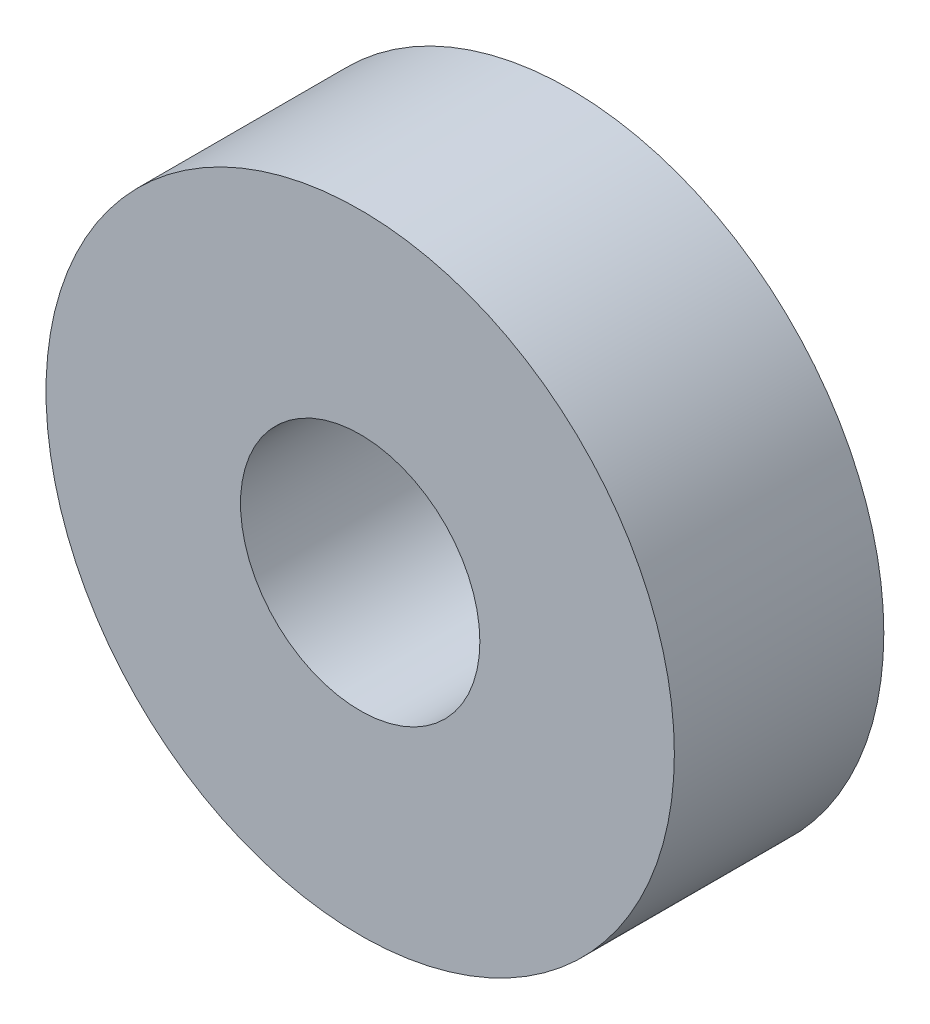
from build123d import *

# Parameters (mm, degrees)
ESQUISSE1_R        = 10.5
ESQUISSE1_R_2      = 4
BOSS_EXTRU_1_DEPTH = 7


with BuildPart() as part:
    # Esquisse1 → Boss.-Extru.1 (new body)
    with BuildSketch(Plane.XY):
        Circle(ESQUISSE1_R)
        Circle(ESQUISSE1_R_2, mode=Mode.SUBTRACT)
    extrude(amount=BOSS_EXTRU_1_DEPTH)


solid = part.part
